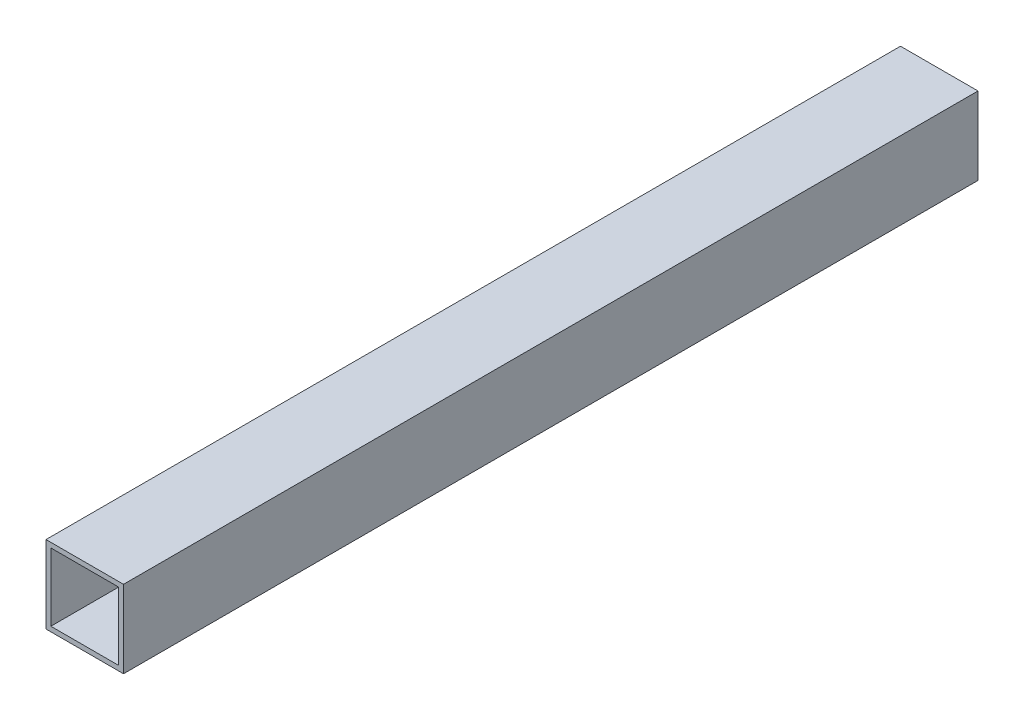
from build123d import *

# Parameters (mm, degrees)
SKETCH1_W           = 25.4
SKETCH1_H           = 25.4
SKETCH1_W_2         = 22.225
SKETCH1_H_2         = 22.225
BOSS_EXTRUDE1_DEPTH = 280


with BuildPart() as part:
    # Sketch1 → Boss-Extrude1 (new body)
    with BuildSketch(Plane.XY):
        Rectangle(SKETCH1_W, SKETCH1_H)
        Rectangle(SKETCH1_W_2, SKETCH1_H_2, mode=Mode.SUBTRACT)
    extrude(amount=BOSS_EXTRUDE1_DEPTH)


solid = part.part
